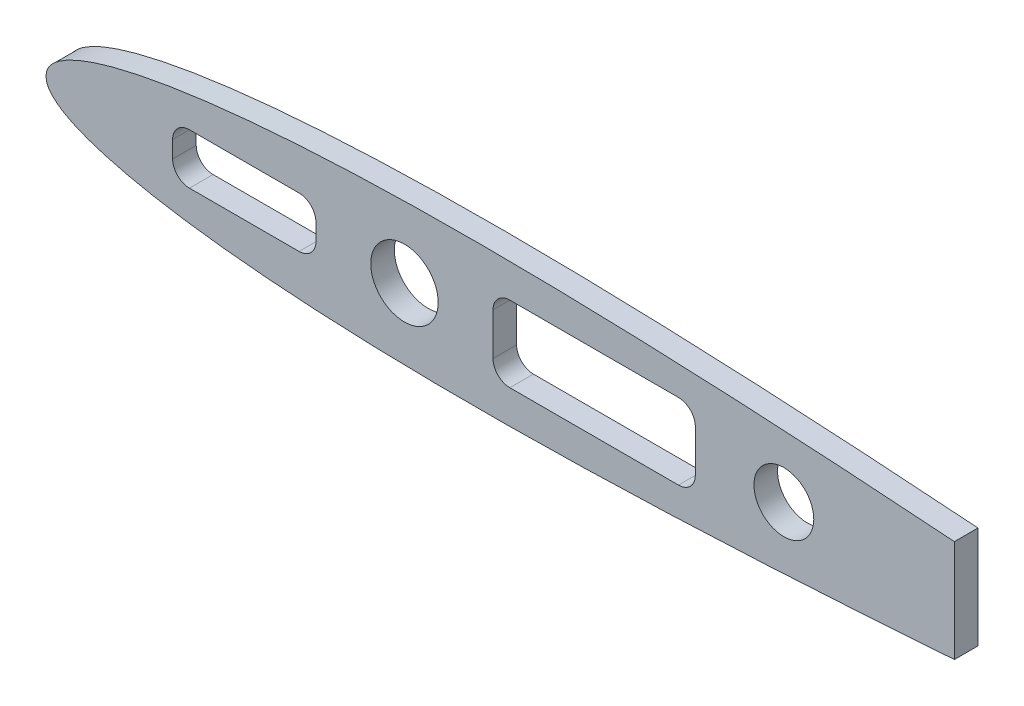
from build123d import *

# Parameters (mm, degrees)
SKETCH_1_R      = 4
SKETCH_1_R_2    = 3.55
EXTRUDE_1_DEPTH = 1.4


with BuildPart() as part:
    # Эскиз1 → Бобышка-Вытянуть1 (new, symmetric)
    with BuildSketch(Plane.XY):
        with BuildLine():
            Line((217.747634119, 2.35e-07), (217.747634119, 6.058113078))
            add(Edge.make_bspline(
                [(217.747634119, 6.058113078), (217.243808474, 6.094887376), (215.071311266, 6.252208631), (211.232977593, 6.52047435), (206.239642946, 6.848873), (201.268368917, 7.153826886), (196.331634567, 7.433105337), (191.441311474, 7.684604439), (186.608700127, 7.906218293), (181.844626933, 8.095958493), (177.159453511, 8.251957682), (172.563150272, 8.372486564), (168.065295924, 8.455953662), (163.675147454, 8.5010027), (159.401643404, 8.506522967), (155.253439756, 8.471528808), (151.238917925, 8.395506076), (147.366223919, 8.277985977), (143.643266298, 8.118975561), (140.077743555, 7.918678943), (136.677139412, 7.677604542), (133.448762895, 7.396480569), (130.399721686, 7.07642431), (127.536961089, 6.718650341), (124.867245825, 6.324666077), (122.397158974, 5.896120566), (120.133109351, 5.434797476), (118.081312133, 4.942567641), (116.247665798, 4.421392386), (114.63793972, 3.873060466), (113.256788366, 3.299309238), (112.109835923, 2.701306388), (111.196336341, 2.078555233), (110.530223642, 1.427069758), (110.085538218, 0.73423022), (110.027578176, 0.23672144), (110, 0)],
                knots=[0.362605011, 0.362605011, 0.362605011, 0.362605011, 0.371392651, 0.400495752, 0.429537687, 0.458441906, 0.487136113, 0.515551917, 0.543623846, 0.571289984, 0.59849081, 0.625169613, 0.651272029, 0.676746158, 0.701541791, 0.725611017, 0.748907835, 0.771387785, 0.793008139, 0.813728033, 0.833507815, 0.852309696, 0.87009731, 0.886835918, 0.902492782, 0.917037139, 0.930441054, 0.942679762, 0.953733567, 0.963589785, 0.972247019, 0.979722225, 0.986065145, 0.991385258, 0.995900989, 1, 1, 1, 1], degree=3))
            add(Edge.make_bspline(
                [(110, 0), (110.027578176, -0.23672144), (110.085538218, -0.73423022), (110.530223642, -1.427069758), (111.196336341, -2.078555233), (112.109835923, -2.701306388), (113.256788366, -3.299309238), (114.63793972, -3.873060466), (116.247665798, -4.421392386), (118.081312133, -4.942567641), (120.133109351, -5.434797476), (122.397158974, -5.896120566), (124.867245825, -6.324666077), (127.536961089, -6.718650341), (130.399721686, -7.07642431), (133.448762895, -7.396480569), (136.677139412, -7.677604542), (140.077743555, -7.918678943), (143.643266298, -8.118975561), (147.366223919, -8.277985977), (151.238917925, -8.395506076), (155.253439756, -8.471528808), (159.401643404, -8.506522967), (163.675147454, -8.5010027), (168.065295924, -8.455953662), (172.563150272, -8.372486564), (177.159453511, -8.251957682), (181.844626933, -8.095958493), (186.608700127, -7.906218293), (191.441311474, -7.684604439), (196.331634567, -7.433105337), (201.268368917, -7.153826886), (206.239642946, -6.848873), (211.232977593, -6.52047435), (215.071311266, -6.252208631), (217.243808474, -6.094887376), (217.747634119, -6.058113078)],
                knots=[0, 0, 0, 0, 0.004099011, 0.008614742, 0.013934855, 0.020277775, 0.027752981, 0.036410215, 0.046266433, 0.057320238, 0.069558946, 0.082962861, 0.097507218, 0.113164082, 0.12990269, 0.147690304, 0.166492185, 0.186271967, 0.206991861, 0.228612215, 0.251092165, 0.274388983, 0.298458209, 0.323253842, 0.348727971, 0.374830387, 0.40150919, 0.428710016, 0.456376154, 0.484448083, 0.512863887, 0.541558094, 0.570462313, 0.599504248, 0.628607349, 0.637394989, 0.637394989, 0.637394989, 0.637394989], degree=3))
            Line((217.747634119, -6.058113078), (217.747634119, 2.35e-07))
        make_face()
        with BuildLine():
            Line((140.01848428, -3), (127.01848428, -3))
            ThreePointArc((127.01848428, -3), (125.604270718, -2.414213562), (125.01848428, -1))
            Line((125.01848428, -1), (125.01848428, 1))
            ThreePointArc((125.01848428, 1), (125.604270718, 2.414213562), (127.01848428, 3))
            Line((127.01848428, 3), (140.01848428, 3))
            ThreePointArc((140.01848428, 3), (141.432697843, 2.414213562), (142.01848428, 1))
            Line((142.01848428, 1), (142.01848428, -1))
            ThreePointArc((142.01848428, -1), (141.432697843, -2.414213562), (140.01848428, -3))
        make_face(mode=Mode.SUBTRACT)
        with Locations((152.51848428, 0)):
            Circle(SKETCH_1_R, mode=Mode.SUBTRACT)
        with BuildLine():
            Line((185.01848428, -4.5), (165.01848428, -4.5))
            ThreePointArc((165.01848428, -4.5), (163.604270718, -3.914213562), (163.01848428, -2.5))
            Line((163.01848428, -2.5), (163.01848428, 2.5))
            ThreePointArc((163.01848428, 2.5), (163.604270718, 3.914213562), (165.01848428, 4.5))
            Line((165.01848428, 4.5), (185.01848428, 4.5))
            ThreePointArc((185.01848428, 4.5), (186.432697843, 3.914213562), (187.01848428, 2.5))
            Line((187.01848428, 2.5), (187.01848428, -2.5))
            ThreePointArc((187.01848428, -2.5), (186.432697843, -3.914213562), (185.01848428, -4.5))
        make_face(mode=Mode.SUBTRACT)
        with Locations((197.51848428, 0)):
            Circle(SKETCH_1_R_2, mode=Mode.SUBTRACT)
    extrude(amount=EXTRUDE_1_DEPTH, both=True)


solid = part.part
